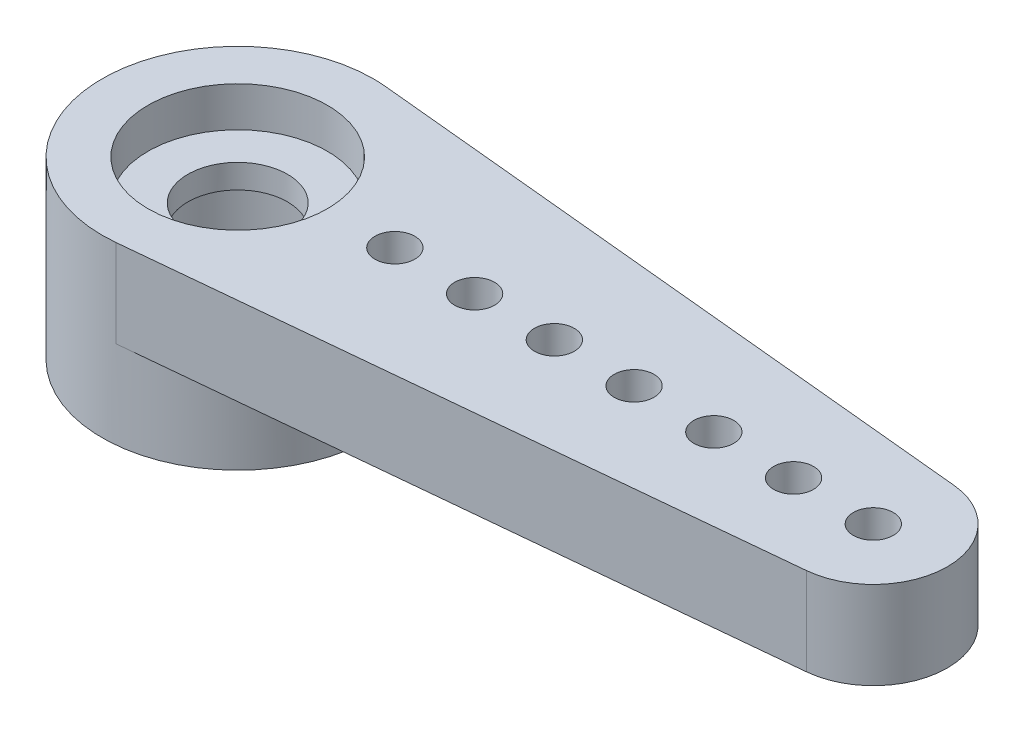
from build123d import *

# Parameters (mm, degrees)
BOSS_EXTRU_1_DEPTH              = 2.2
BOSS_EXTRU_2_START              = 2.2
ESQUISSE2_R                     = 3.4
BOSS_EXTRU_2_DEPTH              = 2.2
ESQUISSE3_R                     = 2.1
ENL_V_MAT_EXTRU_1_DEPTH         = 2.8
DIAM_TRE_DU_PER_AGE_2_5_2_5_1_D = 2.5
DIAM_TRE_DU_PER_AGE_1_0_1_1_D   = 1
ESQUISSE8_R                     = 2.25
ENL_V_MAT_EXTRU_2_DEPTH         = 1


with BuildPart() as part:
    # Esquisse1 → Boss.-Extru.1 (new body)
    with BuildSketch(Plane(origin=(0, 0, 0), x_dir=(1, 0, 0), z_dir=(0, 1, 0))):
        with BuildLine():
            Line((0.32873073, 3.384070937), (16.121002055, 1.85))
            ThreePointArc((16.121002055, 1.85), (17.8, 0), (16.121002055, -1.85))
            Line((16.121002055, -1.85), (0.32873073, -3.384070937))
            ThreePointArc((0.32873073, -3.384070937), (-3.4, 0), (0.32873073, 3.384070937))
        make_face()
    extrude(amount=BOSS_EXTRU_1_DEPTH)

    # Esquisse2 → Boss.-Extru.2 (add)
    with BuildSketch(Plane.XZ.offset(BOSS_EXTRU_2_START)):
        with Locations(Location((0, 0, 0), (0, 0, 270))):
            Circle(ESQUISSE2_R)
    extrude(amount=-BOSS_EXTRU_2_DEPTH)

    # Esquisse3 → Enlèv. mat.-Extru.1 (cut)
    with BuildSketch(Plane.XZ.offset(2.2)):
        with Locations(Location((0, 0, 0), (0, 0, 270))):
            Circle(ESQUISSE3_R)
    extrude(amount=-ENL_V_MAT_EXTRU_1_DEPTH, mode=Mode.SUBTRACT)

    # Diamètre du perçage Ø2.5 (2.5)1 (through all)
    with Locations(Plane(origin=(0, 2.2, 0), x_dir=(1, 0, 0), z_dir=(0, 1, 0))):
        with Locations((0, 0)):
            Hole(DIAM_TRE_DU_PER_AGE_2_5_2_5_1_D / 2)

    # Diamètre du perçage Ø1.0 (1)1 (through all)
    with Locations(Plane(origin=(0, 0, 0), x_dir=(-1, 0, 0), z_dir=(0, -1, 0))):
        with Locations((-15.941291918, 0), (-13.941291918, 0), (-11.941291918, 0), (-9.941291918, 0), (-7.941291918, 0), (-5.941291918, 0), (-3.941291918, 0)):
            Hole(DIAM_TRE_DU_PER_AGE_1_0_1_1_D / 2)

    # Esquisse8 → Enlèv. mat.-Extru.2 (cut)
    with BuildSketch(Plane(origin=(0, 2.2, 0), x_dir=(1, 0, 0), z_dir=(0, 1, 0))):
        with Locations(Location((0, 0, 0), (0, 0, 270))):
            Circle(ESQUISSE8_R)
    extrude(amount=-ENL_V_MAT_EXTRU_2_DEPTH, mode=Mode.SUBTRACT)


solid = part.part
